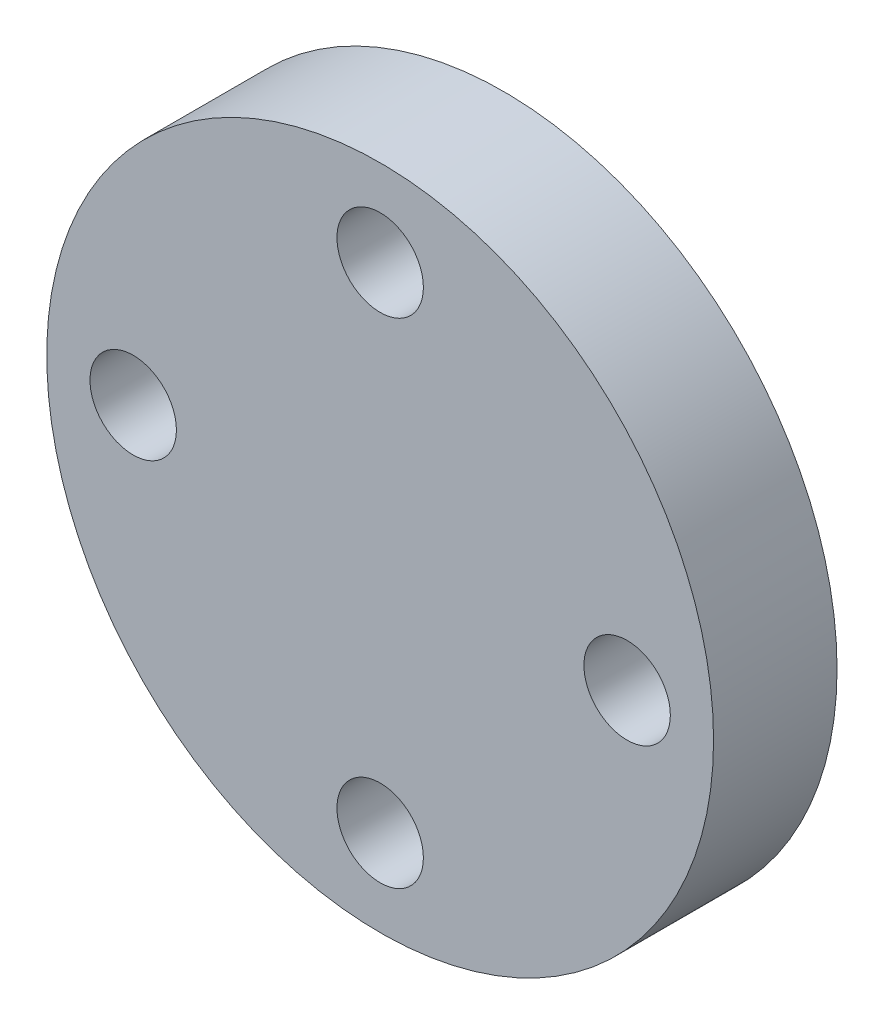
from build123d import *

# Parameters (mm, degrees)
SKETCH1_R           = 13.5
SKETCH1_R_2         = 1.75
BOSS_EXTRUDE1_DEPTH = 5


with BuildPart() as part:
    # Sketch1 → Boss-Extrude1 (new body)
    with BuildSketch(Plane.XY):
        Circle(SKETCH1_R)
        with Locations((-10, 0)):
            Circle(SKETCH1_R_2, mode=Mode.SUBTRACT)
        with Locations((0, 10)):
            Circle(SKETCH1_R_2, mode=Mode.SUBTRACT)
        with Locations((10, 0)):
            Circle(SKETCH1_R_2, mode=Mode.SUBTRACT)
        with Locations((0, -10)):
            Circle(SKETCH1_R_2, mode=Mode.SUBTRACT)
    extrude(amount=BOSS_EXTRUDE1_DEPTH)


solid = part.part
